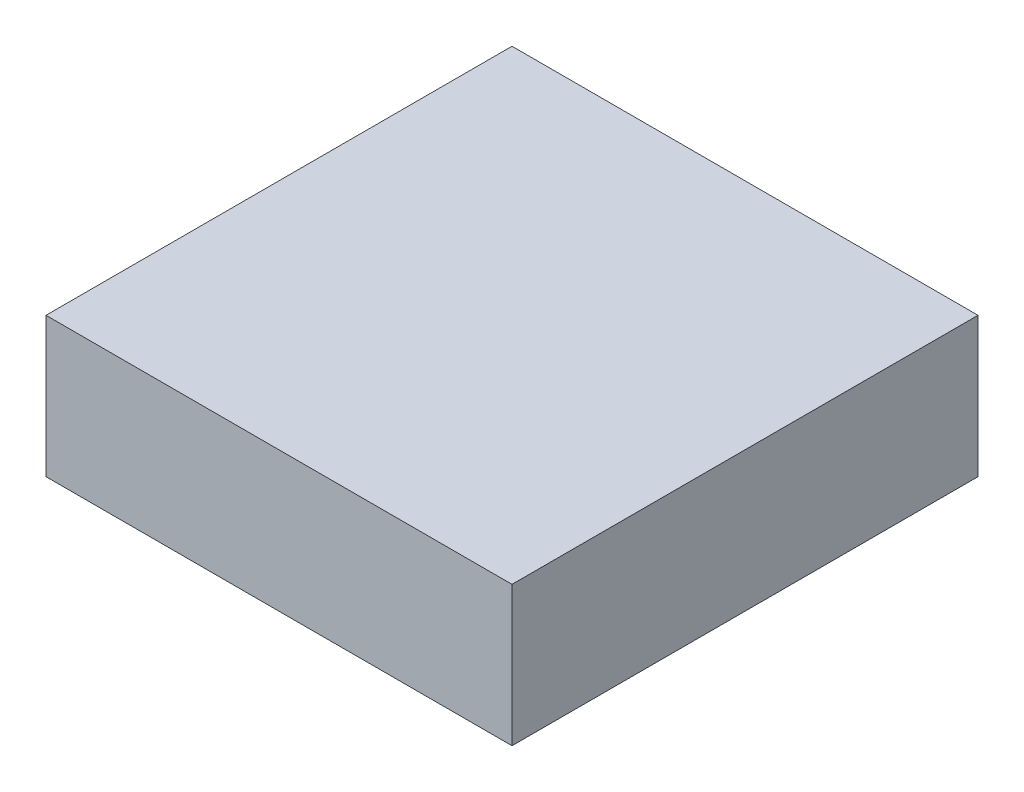
from build123d import *

# Parameters (mm, degrees)
SKETCH_1_W      = 60
SKETCH_1_H      = 60
EXTRUDE_1_DEPTH = 18


with BuildPart() as part:
    # 草图1 → 凸台-拉伸1 (new body)
    with BuildSketch(Plane(origin=(0, 0, 0), x_dir=(1, 0, 0), z_dir=(0, 1, 0))):
        Rectangle(SKETCH_1_W, SKETCH_1_H)
    extrude(amount=EXTRUDE_1_DEPTH)


solid = part.part
